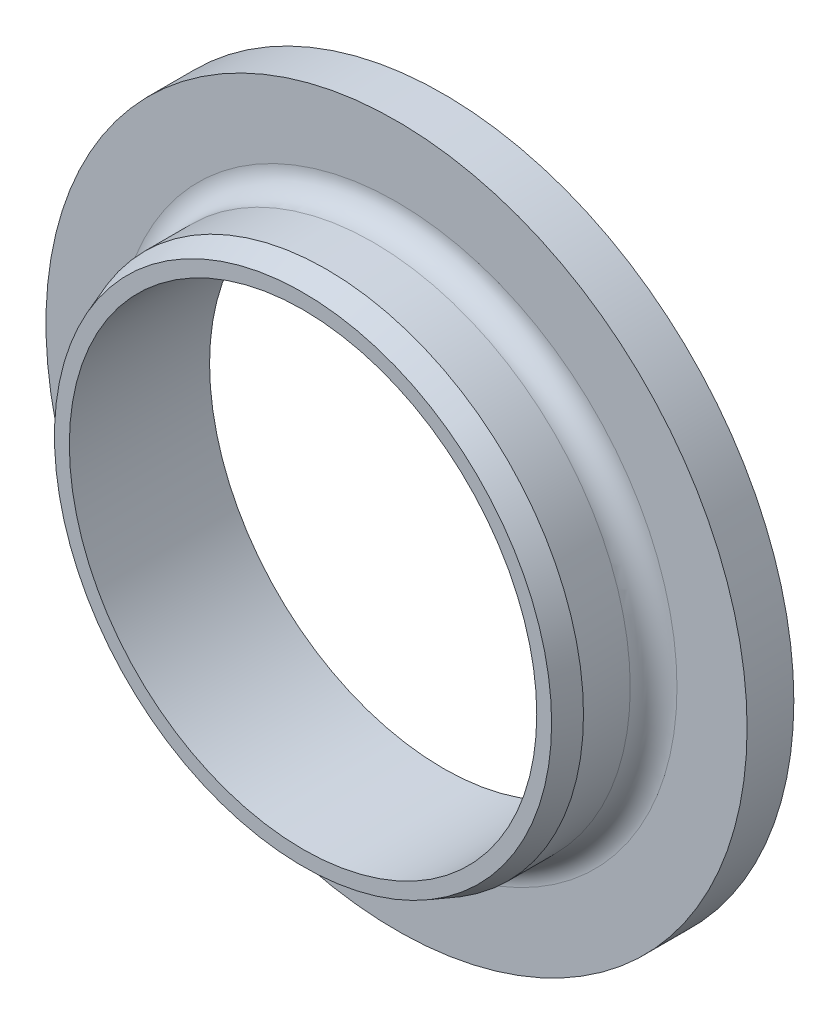
from build123d import *


with BuildPart() as part:
    # Sketch1 → Revolve1 (revolve)
    with BuildSketch(Plane(origin=(0, 0, 0), x_dir=(1, 0, 0), z_dir=(0, 1, 0))):
        with BuildLine():
            Line((5.5, -2.5), (5.5, -1.5))
            ThreePointArc((5.5, -1.5), (5.646446609, -1.146446609), (6, -1))
            Line((6, -1), (7.5, -1))
            Line((7.5, -1), (7.5, 0))
            Line((7.5, 0), (5, 0))
            Line((5, 0), (5, -3))
            Line((5, -3), (5.318014883, -3))
            Line((5.318014883, -3), (5.5, -2.5))
        make_face()
    revolve(axis=Axis((0, 0, 0), (0, 0, 1)))


solid = part.part
